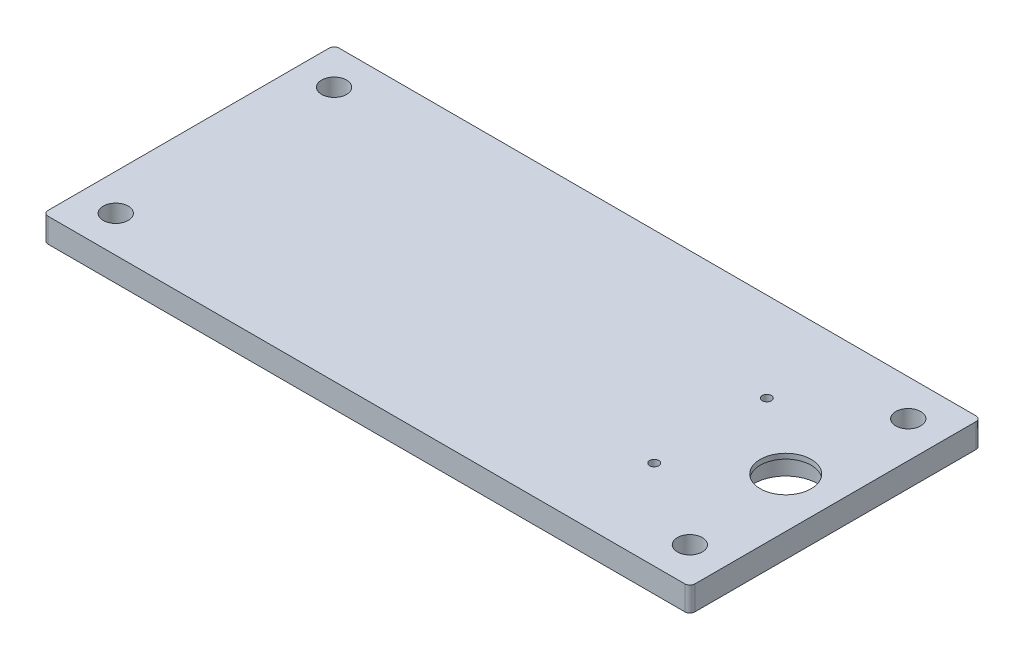
from build123d import *

# Parameters (mm, degrees)
SKETCH1_W                   = 254
SKETCH1_H                   = 114.3
BOSS_EXTRUDE1_DEPTH         = 9.525
SKETCH2_R                   = 10
CUT_EXTRUDE1_DEPTH          = 140.5917194
F_3_8_CLEARANCE_HOLE1_D     = 9.8044
F_3_8_CLEARANCE_HOLE1_DEPTH = 10
F_3_8_CLEARANCE_HOLE1_TIP   = 2.945538927
FILLET1_R                   = 2
M3_CLEARANCE_HOLE1_D        = 3.6
M3_CLEARANCE_HOLE1_DEPTH    = 10
M3_CLEARANCE_HOLE1_TIP      = 1.081549114
CUT_EXTRUDE2_START          = -7.525
SKETCH11_R                  = 12.5
SKETCH11_R_2                = 10
CUT_EXTRUDE2_DEPTH          = 7.525


with BuildPart() as part:
    # Sketch1 → Boss-Extrude1 (new body)
    with BuildSketch(Plane(origin=(0, 0, 0), x_dir=(1, 0, 0), z_dir=(0, 1, 0))):
        Rectangle(SKETCH1_W, SKETCH1_H)
    extrude(amount=BOSS_EXTRUDE1_DEPTH)

    # Sketch2 → Cut-Extrude1 (cut, through all)
    with BuildSketch(Plane(origin=(0, 9.525, 0), x_dir=(1, 0, 0), z_dir=(0, 1, 0))):
        with Locations(Location((107.475, 0, 0), (0, 0, 270))):
            Circle(SKETCH2_R)
    extrude(amount=-CUT_EXTRUDE1_DEPTH, mode=Mode.SUBTRACT)

    # 3/8 Clearance Hole1
    with Locations(Plane(origin=(0, 9.525, 0), x_dir=(1, 0, 0), z_dir=(0, 1, 0))):
        with Locations((112.7125, 42.8625), (112.7125, -42.8675), (-112.7175, -42.8675), (-112.7175, 42.8625)):
            Hole(F_3_8_CLEARANCE_HOLE1_D / 2, depth=F_3_8_CLEARANCE_HOLE1_DEPTH)
            with Locations((0, 0, -(F_3_8_CLEARANCE_HOLE1_DEPTH + F_3_8_CLEARANCE_HOLE1_TIP / 2))):  # 118° drill point
                Cone(0, F_3_8_CLEARANCE_HOLE1_D / 2, F_3_8_CLEARANCE_HOLE1_TIP, mode=Mode.SUBTRACT)

    # Fillet1
    fillet1_edges = [part.edges().sort_by_distance(p)[0] for p in [
        (127, 4.7625, 57.15),
        (-127, 4.7625, 57.15),
        (-127, 4.7625, -57.15),
        (127, 4.7625, -57.15),
    ]]
    fillet(fillet1_edges, radius=FILLET1_R)

    # M3 Clearance Hole1
    with Locations(Plane.XZ):
        with Locations((77.95, 22.1), (77.95, -22.1)):
            Hole(M3_CLEARANCE_HOLE1_D / 2, depth=M3_CLEARANCE_HOLE1_DEPTH)
            with Locations((0, 0, -(M3_CLEARANCE_HOLE1_DEPTH + M3_CLEARANCE_HOLE1_TIP / 2))):  # 118° drill point
                Cone(0, M3_CLEARANCE_HOLE1_D / 2, M3_CLEARANCE_HOLE1_TIP, mode=Mode.SUBTRACT)

    # Sketch11 → Cut-Extrude2 (cut)
    with BuildSketch(Plane.XZ.offset(CUT_EXTRUDE2_START)):
        with Locations(Location((107.475, 0, 0), (0, 0, 270))):
            Circle(SKETCH11_R)
        with Locations(Location((107.475, 0, 0), (0, 0, 90))):
            Circle(SKETCH11_R_2, mode=Mode.SUBTRACT)
    extrude(amount=CUT_EXTRUDE2_DEPTH, mode=Mode.SUBTRACT)


solid = part.part
